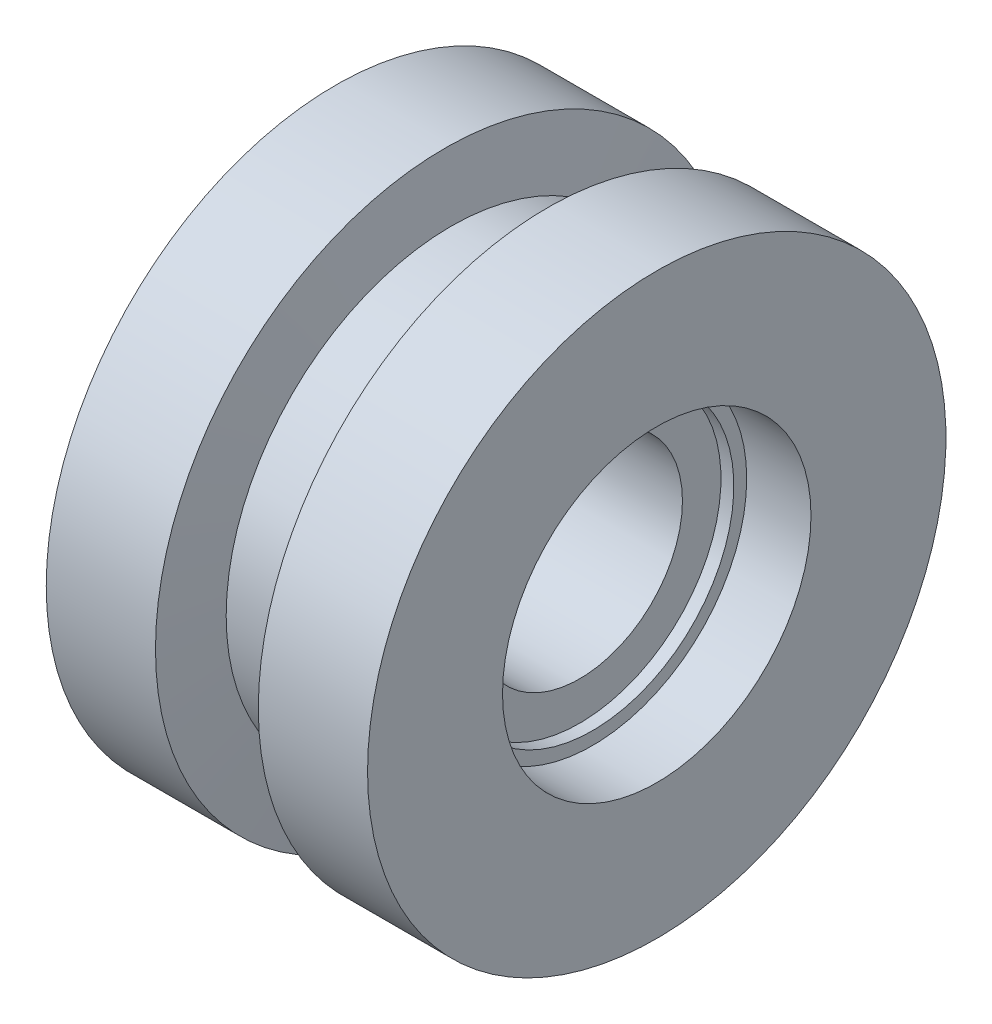
from build123d import *


with BuildPart() as part:
    # Sketch1 → Revolve1 (revolve)
    with BuildSketch(Plane(origin=(0, 0, 0), x_dir=(1, 0, 0), z_dir=(0, 1, 0)), mode=Mode.PRIVATE) as revolve1_sk:
        Polygon((0, 22.5), (25, 22.5), (25, 12), (20, 12), (20, 10.996991643), (19, 10.996991643), (19, 8), (6, 8), (6, 10.996991643), (5, 10.996991643), (5, 12), (0, 12), align=None)
    revolve(revolve1_sk.sketch.rotate(Axis((0, 0, 0), (1, 0, 0)), 180), axis=Axis((0, 0, 0), (1, 0, 0)))

    # Sketch4 → Cut-Revolve1 (revolve, cut)
    with BuildSketch(Plane(origin=(0, 0, 0), x_dir=(1, 0, 0), z_dir=(0, 1, 0)), mode=Mode.PRIVATE) as cut_revolve1_sk:
        Polygon((8.5, 22.5), (9, 17.5), (16, 17.5), (16.5, 22.5), align=None)
    revolve(cut_revolve1_sk.sketch.rotate(Axis((0, 0, 0), (1, 0, 0)), 180), axis=Axis((0, 0, 0), (1, 0, 0)), mode=Mode.SUBTRACT)


solid = part.part
